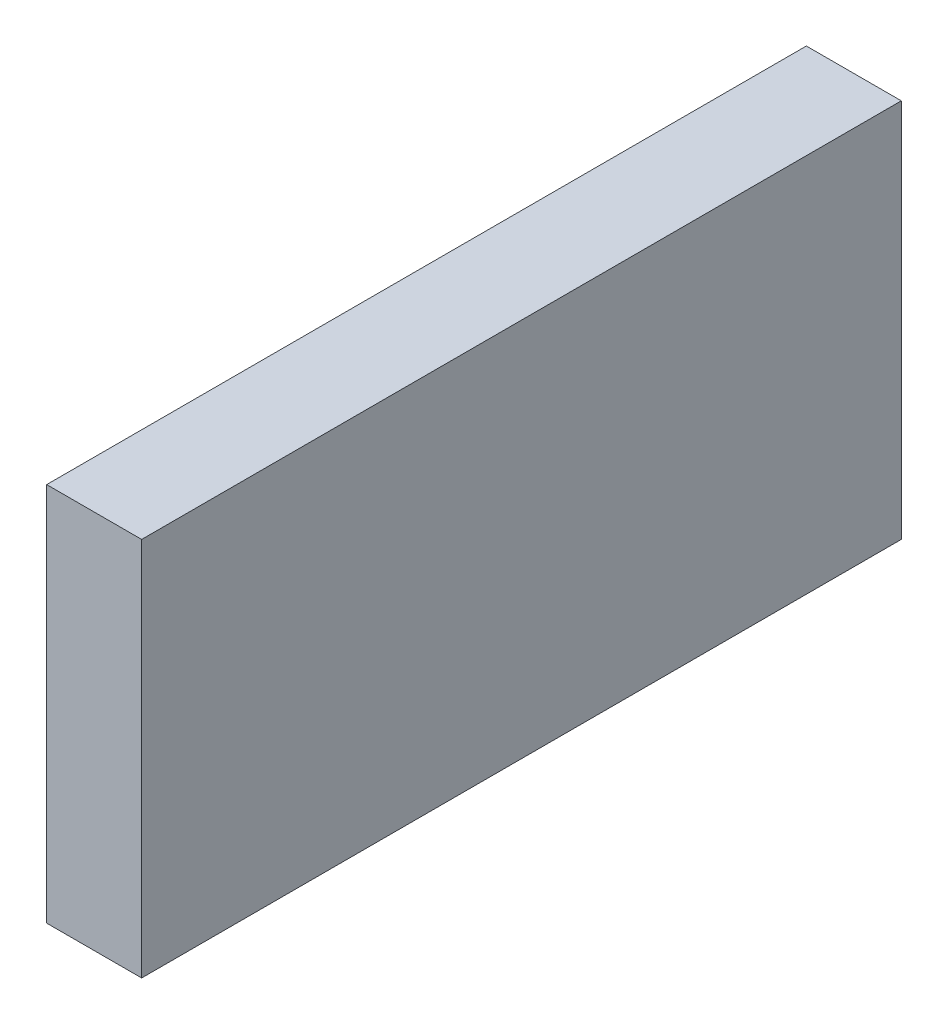
from build123d import *

# Parameters (mm, degrees)
SKETCH1_W           = 6.35
SKETCH1_H           = 25.4
BOSS_EXTRUDE1_DEPTH = 50.8


with BuildPart() as part:
    # Sketch1 → Boss-Extrude1 (new body)
    with BuildSketch(Plane.XY):
        with Locations((3.175, 12.7)):
            Rectangle(SKETCH1_W, SKETCH1_H)
    extrude(amount=BOSS_EXTRUDE1_DEPTH)


solid = part.part
